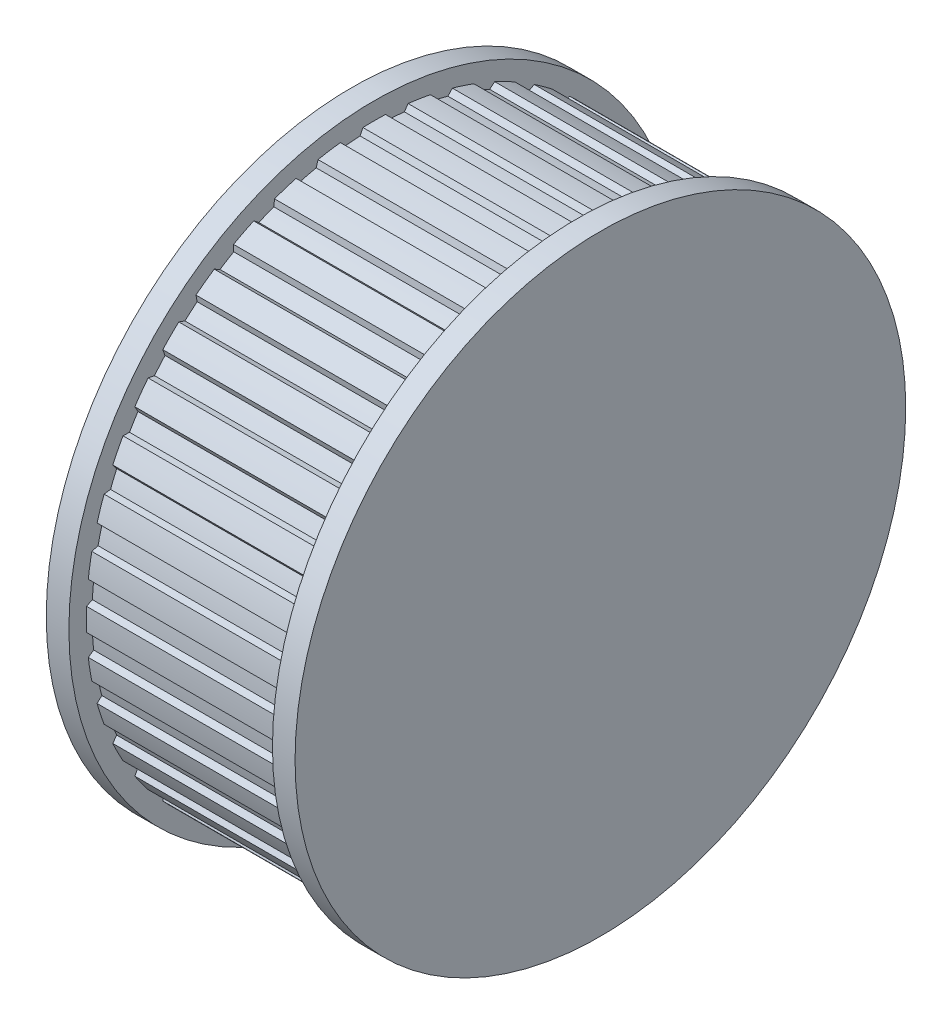
from build123d import *

# Parameters (mm, degrees)
BOSS_EXTRUDE1_DEPTH     = 9
SKETCH6_R               = 13.5
BOSS_EXTRUDE2_DEPTH     = 1
BOSS_EXTRUDE3_START     = -10
SKETCH6_3_R             = 13.5
BOSS_EXTRUDE3_DEPTH     = 1
SKETCH7_R               = 5
BOSS_EXTRUDE4_DEPTH     = 6
SKETCH8_R               = 2
CUT_EXTRUDE1_DEPTH      = 6
CUT_EXTRUDE2_REACH      = 26.99
CUT_EXTRUDE2_END_RADIUS = 2
SKETCH9_R               = 1.6


with BuildPart() as part:
    # Sketch5 → Boss-Extrude1 (new body)
    with BuildSketch(Plane(origin=(0, 0, 0), x_dir=(0, 0, -1), z_dir=(1, 0, 0))):
        with BuildLine():
            Line((-0.622813523, 12.459443339), (-0.499777455, 12.720185631))
            ThreePointArc((-0.499777455, 12.720185631), (0, 12.73), (0.499777455, 12.720185631))
            Line((0.499777455, 12.720185631), (0.622813523, 12.459443339))
            ThreePointArc((0.622813523, 12.459443339), (0.978777219, 12.436543738), (1.333940698, 12.403476416))
            Line((1.333940698, 12.403476416), (1.49625107, 12.641761457))
            ThreePointArc((1.49625107, 12.641761457), (1.99141074, 12.573272576), (2.483499799, 12.48539662))
            Line((2.483499799, 12.48539662), (2.564232009, 12.208617416))
            ThreePointArc((2.564232009, 12.208617416), (2.912230914, 12.130314757), (3.257848872, 12.04209474))
            Line((3.257848872, 12.04209474), (3.455436927, 12.25205516))
            ThreePointArc((3.455436927, 12.25205516), (3.933786338, 12.106949452), (4.406070137, 11.943175706))
            Line((4.406070137, 11.943175706), (4.442510592, 11.657174814))
            ThreePointArc((4.442510592, 11.657174814), (4.773975819, 11.525397168), (5.101537995, 11.384196725))
            Line((5.101537995, 11.384196725), (5.329538459, 11.560662603))
            ThreePointArc((5.329538459, 11.560662603), (5.779299062, 11.342513053), (6.220148404, 11.10687417))
            Line((6.220148404, 11.10687417), (6.211399821, 10.81869388))
            ThreePointArc((6.211399821, 10.81869388), (6.518169595, 10.63668605), (6.819610322, 10.445982006))
            Line((6.819610322, 10.445982006), (7.072409066, 10.584608165))
            ThreePointArc((7.072409066, 10.584608165), (7.482506262, 10.298786338), (7.881065975, 9.99708453))
            Line((7.881065975, 9.99708453), (7.827343771, 9.713820798))
            ThreePointArc((7.827343771, 9.713820798), (8.101864403, 9.486064421), (8.369761209, 9.250552541))
            Line((8.369761209, 9.250552541), (8.641133491, 9.347925545))
            ThreePointArc((8.641133491, 9.347925545), (9.001469325, 9.001469325), (9.347925545, 8.641133491))
            Line((9.347925545, 8.641133491), (9.250552541, 8.369761209))
            ThreePointArc((9.250552541, 8.369761209), (9.486064421, 8.101864403), (9.713820798, 7.827343771))
            Line((9.713820798, 7.827343771), (9.99708453, 7.881065975))
            ThreePointArc((9.99708453, 7.881065975), (10.298786338, 7.482506262), (10.584608165, 7.072409066))
            Line((10.584608165, 7.072409066), (10.445982006, 6.819610322))
            ThreePointArc((10.445982006, 6.819610322), (10.63668605, 6.518169595), (10.81869388, 6.211399821))
            Line((10.81869388, 6.211399821), (11.10687417, 6.220148404))
            ThreePointArc((11.10687417, 6.220148404), (11.342513053, 5.779299062), (11.560662603, 5.329538459))
            Line((11.560662603, 5.329538459), (11.384196725, 5.101537995))
            ThreePointArc((11.384196725, 5.101537995), (11.525397168, 4.773975819), (11.657174814, 4.442510592))
            Line((11.657174814, 4.442510592), (11.943175706, 4.406070137))
            ThreePointArc((11.943175706, 4.406070137), (12.106949452, 3.933786338), (12.25205516, 3.455436927))
            Line((12.25205516, 3.455436927), (12.04209474, 3.257848872))
            ThreePointArc((12.04209474, 3.257848872), (12.130314757, 2.912230914), (12.208617416, 2.564232009))
            Line((12.208617416, 2.564232009), (12.48539662, 2.483499799))
            ThreePointArc((12.48539662, 2.483499799), (12.573272576, 1.99141074), (12.641761457, 1.49625107))
            Line((12.641761457, 1.49625107), (12.403476416, 1.333940698))
            ThreePointArc((12.403476416, 1.333940698), (12.436543738, 0.978777219), (12.459443339, 0.622813523))
            Line((12.459443339, 0.622813523), (12.720185631, 0.499777455))
            ThreePointArc((12.720185631, 0.499777455), (12.73, 0), (12.720185631, -0.499777455))
            Line((12.720185631, -0.499777455), (12.459443339, -0.622813523))
            ThreePointArc((12.459443339, -0.622813523), (12.436543738, -0.978777219), (12.403476416, -1.333940698))
            Line((12.403476416, -1.333940698), (12.641761457, -1.49625107))
            ThreePointArc((12.641761457, -1.49625107), (12.573272576, -1.99141074), (12.48539662, -2.483499799))
            Line((12.48539662, -2.483499799), (12.208617416, -2.564232009))
            ThreePointArc((12.208617416, -2.564232009), (12.130314757, -2.912230914), (12.04209474, -3.257848872))
            Line((12.04209474, -3.257848872), (12.25205516, -3.455436927))
            ThreePointArc((12.25205516, -3.455436927), (12.106949452, -3.933786338), (11.943175706, -4.406070137))
            Line((11.943175706, -4.406070137), (11.657174814, -4.442510592))
            ThreePointArc((11.657174814, -4.442510592), (11.525397168, -4.773975819), (11.384196725, -5.101537995))
            Line((11.384196725, -5.101537995), (11.560662603, -5.329538459))
            ThreePointArc((11.560662603, -5.329538459), (11.342513053, -5.779299062), (11.10687417, -6.220148404))
            Line((11.10687417, -6.220148404), (10.81869388, -6.211399821))
            ThreePointArc((10.81869388, -6.211399821), (10.63668605, -6.518169595), (10.445982006, -6.819610322))
            Line((10.445982006, -6.819610322), (10.584608165, -7.072409066))
            ThreePointArc((10.584608165, -7.072409066), (10.298786338, -7.482506262), (9.99708453, -7.881065975))
            Line((9.99708453, -7.881065975), (9.713820798, -7.827343771))
            ThreePointArc((9.713820798, -7.827343771), (9.486064421, -8.101864403), (9.250552541, -8.369761209))
            Line((9.250552541, -8.369761209), (9.347925545, -8.641133491))
            ThreePointArc((9.347925545, -8.641133491), (9.001469325, -9.001469325), (8.641133491, -9.347925545))
            Line((8.641133491, -9.347925545), (8.369761209, -9.250552541))
            ThreePointArc((8.369761209, -9.250552541), (8.101864403, -9.486064421), (7.827343771, -9.713820798))
            Line((7.827343771, -9.713820798), (7.881065975, -9.99708453))
            ThreePointArc((7.881065975, -9.99708453), (7.482506262, -10.298786338), (7.072409066, -10.584608165))
            Line((7.072409066, -10.584608165), (6.819610322, -10.445982006))
            ThreePointArc((6.819610322, -10.445982006), (6.518169595, -10.63668605), (6.211399821, -10.81869388))
            Line((6.211399821, -10.81869388), (6.220148404, -11.10687417))
            ThreePointArc((6.220148404, -11.10687417), (5.779299062, -11.342513053), (5.329538459, -11.560662603))
            Line((5.329538459, -11.560662603), (5.101537995, -11.384196725))
            ThreePointArc((5.101537995, -11.384196725), (4.773975819, -11.525397168), (4.442510592, -11.657174814))
            Line((4.442510592, -11.657174814), (4.406070137, -11.943175706))
            ThreePointArc((4.406070137, -11.943175706), (3.933786338, -12.106949452), (3.455436927, -12.25205516))
            Line((3.455436927, -12.25205516), (3.257848872, -12.04209474))
            ThreePointArc((3.257848872, -12.04209474), (2.912230914, -12.130314757), (2.564232009, -12.208617416))
            Line((2.564232009, -12.208617416), (2.483499799, -12.48539662))
            ThreePointArc((2.483499799, -12.48539662), (1.99141074, -12.573272576), (1.49625107, -12.641761457))
            Line((1.49625107, -12.641761457), (1.333940698, -12.403476416))
            ThreePointArc((1.333940698, -12.403476416), (0.978777219, -12.436543738), (0.622813523, -12.459443339))
            Line((0.622813523, -12.459443339), (0.499777455, -12.720185631))
            ThreePointArc((0.499777455, -12.720185631), (0, -12.73), (-0.499777455, -12.720185631))
            Line((-0.499777455, -12.720185631), (-0.622813523, -12.459443339))
            ThreePointArc((-0.622813523, -12.459443339), (-0.978777219, -12.436543738), (-1.333940698, -12.403476416))
            Line((-1.333940698, -12.403476416), (-1.49625107, -12.641761457))
            ThreePointArc((-1.49625107, -12.641761457), (-1.99141074, -12.573272576), (-2.483499799, -12.48539662))
            Line((-2.483499799, -12.48539662), (-2.564232009, -12.208617416))
            ThreePointArc((-2.564232009, -12.208617416), (-2.912230914, -12.130314757), (-3.257848872, -12.04209474))
            Line((-3.257848872, -12.04209474), (-3.455436927, -12.25205516))
            ThreePointArc((-3.455436927, -12.25205516), (-3.933786338, -12.106949452), (-4.406070137, -11.943175706))
            Line((-4.406070137, -11.943175706), (-4.442510592, -11.657174814))
            ThreePointArc((-4.442510592, -11.657174814), (-4.773975819, -11.525397168), (-5.101537995, -11.384196725))
            Line((-5.101537995, -11.384196725), (-5.329538459, -11.560662603))
            ThreePointArc((-5.329538459, -11.560662603), (-5.779299062, -11.342513053), (-6.220148404, -11.10687417))
            Line((-6.220148404, -11.10687417), (-6.211399821, -10.81869388))
            ThreePointArc((-6.211399821, -10.81869388), (-6.518169595, -10.63668605), (-6.819610322, -10.445982006))
            Line((-6.819610322, -10.445982006), (-7.072409066, -10.584608165))
            ThreePointArc((-7.072409066, -10.584608165), (-7.482506262, -10.298786338), (-7.881065975, -9.99708453))
            Line((-7.881065975, -9.99708453), (-7.827343771, -9.713820798))
            ThreePointArc((-7.827343771, -9.713820798), (-8.101864403, -9.486064421), (-8.369761209, -9.250552541))
            Line((-8.369761209, -9.250552541), (-8.641133491, -9.347925545))
            ThreePointArc((-8.641133491, -9.347925545), (-9.001469325, -9.001469325), (-9.347925545, -8.641133491))
            Line((-9.347925545, -8.641133491), (-9.250552541, -8.369761209))
            ThreePointArc((-9.250552541, -8.369761209), (-9.486064421, -8.101864403), (-9.713820798, -7.827343771))
            Line((-9.713820798, -7.827343771), (-9.99708453, -7.881065975))
            ThreePointArc((-9.99708453, -7.881065975), (-10.298786338, -7.482506262), (-10.584608165, -7.072409066))
            Line((-10.584608165, -7.072409066), (-10.445982006, -6.819610322))
            ThreePointArc((-10.445982006, -6.819610322), (-10.63668605, -6.518169595), (-10.81869388, -6.211399821))
            Line((-10.81869388, -6.211399821), (-11.10687417, -6.220148404))
            ThreePointArc((-11.10687417, -6.220148404), (-11.342513053, -5.779299062), (-11.560662603, -5.329538459))
            Line((-11.560662603, -5.329538459), (-11.384196725, -5.101537995))
            ThreePointArc((-11.384196725, -5.101537995), (-11.525397168, -4.773975819), (-11.657174814, -4.442510592))
            Line((-11.657174814, -4.442510592), (-11.943175706, -4.406070137))
            ThreePointArc((-11.943175706, -4.406070137), (-12.106949452, -3.933786338), (-12.25205516, -3.455436927))
            Line((-12.25205516, -3.455436927), (-12.04209474, -3.257848872))
            ThreePointArc((-12.04209474, -3.257848872), (-12.130314757, -2.912230914), (-12.208617416, -2.564232009))
            Line((-12.208617416, -2.564232009), (-12.48539662, -2.483499799))
            ThreePointArc((-12.48539662, -2.483499799), (-12.573272576, -1.99141074), (-12.641761457, -1.49625107))
            Line((-12.641761457, -1.49625107), (-12.403476416, -1.333940698))
            ThreePointArc((-12.403476416, -1.333940698), (-12.436543738, -0.978777219), (-12.459443339, -0.622813523))
            Line((-12.459443339, -0.622813523), (-12.720185631, -0.499777455))
            ThreePointArc((-12.720185631, -0.499777455), (-12.73, 0), (-12.720185631, 0.499777455))
            Line((-12.720185631, 0.499777455), (-12.459443339, 0.622813523))
            ThreePointArc((-12.459443339, 0.622813523), (-12.436543738, 0.978777219), (-12.403476416, 1.333940698))
            Line((-12.403476416, 1.333940698), (-12.641761457, 1.49625107))
            ThreePointArc((-12.641761457, 1.49625107), (-12.573272576, 1.99141074), (-12.48539662, 2.483499799))
            Line((-12.48539662, 2.483499799), (-12.208617416, 2.564232009))
            ThreePointArc((-12.208617416, 2.564232009), (-12.130314757, 2.912230914), (-12.04209474, 3.257848872))
            Line((-12.04209474, 3.257848872), (-12.25205516, 3.455436927))
            ThreePointArc((-12.25205516, 3.455436927), (-12.106949452, 3.933786338), (-11.943175706, 4.406070137))
            Line((-11.943175706, 4.406070137), (-11.657174814, 4.442510592))
            ThreePointArc((-11.657174814, 4.442510592), (-11.525397168, 4.773975819), (-11.384196725, 5.101537995))
            Line((-11.384196725, 5.101537995), (-11.560662603, 5.329538459))
            ThreePointArc((-11.560662603, 5.329538459), (-11.342513053, 5.779299062), (-11.10687417, 6.220148404))
            Line((-11.10687417, 6.220148404), (-10.81869388, 6.211399821))
            ThreePointArc((-10.81869388, 6.211399821), (-10.63668605, 6.518169595), (-10.445982006, 6.819610322))
            Line((-10.445982006, 6.819610322), (-10.584608165, 7.072409066))
            ThreePointArc((-10.584608165, 7.072409066), (-10.298786338, 7.482506262), (-9.99708453, 7.881065975))
            Line((-9.99708453, 7.881065975), (-9.713820798, 7.827343771))
            ThreePointArc((-9.713820798, 7.827343771), (-9.486064421, 8.101864403), (-9.250552541, 8.369761209))
            Line((-9.250552541, 8.369761209), (-9.347925545, 8.641133491))
            ThreePointArc((-9.347925545, 8.641133491), (-9.001469325, 9.001469325), (-8.641133491, 9.347925545))
            Line((-8.641133491, 9.347925545), (-8.369761209, 9.250552541))
            ThreePointArc((-8.369761209, 9.250552541), (-8.101864403, 9.486064421), (-7.827343771, 9.713820798))
            Line((-7.827343771, 9.713820798), (-7.881065975, 9.99708453))
            ThreePointArc((-7.881065975, 9.99708453), (-7.482506262, 10.298786338), (-7.072409066, 10.584608165))
            Line((-7.072409066, 10.584608165), (-6.819610322, 10.445982006))
            ThreePointArc((-6.819610322, 10.445982006), (-6.518169595, 10.63668605), (-6.211399821, 10.81869388))
            Line((-6.211399821, 10.81869388), (-6.220148404, 11.10687417))
            ThreePointArc((-6.220148404, 11.10687417), (-5.779299062, 11.342513053), (-5.329538459, 11.560662603))
            Line((-5.329538459, 11.560662603), (-5.101537995, 11.384196725))
            ThreePointArc((-5.101537995, 11.384196725), (-4.773975819, 11.525397168), (-4.442510592, 11.657174814))
            Line((-4.442510592, 11.657174814), (-4.406070137, 11.943175706))
            ThreePointArc((-4.406070137, 11.943175706), (-3.933786338, 12.106949452), (-3.455436927, 12.25205516))
            Line((-3.455436927, 12.25205516), (-3.257848872, 12.04209474))
            ThreePointArc((-3.257848872, 12.04209474), (-2.912230914, 12.130314757), (-2.564232009, 12.208617416))
            Line((-2.564232009, 12.208617416), (-2.483499799, 12.48539662))
            ThreePointArc((-2.483499799, 12.48539662), (-1.99141074, 12.573272576), (-1.49625107, 12.641761457))
            Line((-1.49625107, 12.641761457), (-1.333940698, 12.403476416))
            ThreePointArc((-1.333940698, 12.403476416), (-0.978777219, 12.436543738), (-0.622813523, 12.459443339))
        make_face()
    extrude(amount=BOSS_EXTRUDE1_DEPTH)

    # Sketch6 → Boss-Extrude2 (add)
    with BuildSketch(Plane(origin=(9, 0, 0), x_dir=(0, 0, -1), z_dir=(1, 0, 0))):
        Circle(SKETCH6_R)
    extrude(amount=BOSS_EXTRUDE2_DEPTH)

    # Sketch6<3> → Boss-Extrude3 (add)
    with BuildSketch(Plane(origin=(9, 0, 0), x_dir=(0, 0, -1), z_dir=(1, 0, 0)).offset(BOSS_EXTRUDE3_START)):
        Circle(SKETCH6_3_R)
    extrude(amount=BOSS_EXTRUDE3_DEPTH)

    # Sketch7 → Boss-Extrude4 (add)
    with BuildSketch(Plane.ZY.offset(1)):
        Circle(SKETCH7_R)
    extrude(amount=BOSS_EXTRUDE4_DEPTH)

    # Sketch8 → Cut-Extrude1 (cut)
    with BuildSketch(Plane.ZY.offset(7)):
        Circle(SKETCH8_R)
    extrude(amount=-CUT_EXTRUDE1_DEPTH, mode=Mode.SUBTRACT)

    # Cut-Extrude2: up to this cylinder (the profile starts outside it)
    cut_extrude2_end = Plane(origin=(-4, 0, 0), z_dir=(-1, 0, 0)) * Cylinder(CUT_EXTRUDE2_END_RADIUS, 58.98, mode=Mode.PRIVATE)
    # Sketch9 → Cut-Extrude2 (cut, up to the surface)
    with BuildSketch(Plane(origin=(0, 5, 0), x_dir=(1, 0, 0), z_dir=(0, 1, 0)), mode=Mode.PRIVATE) as cut_extrude2_sk1:
        with Locations(Location((-4, 0, 0), (0, 0, 270))):
            Circle(SKETCH9_R)
    cut_extrude2_tool1 = extrude(cut_extrude2_sk1.sketch, amount=-CUT_EXTRUDE2_REACH, mode=Mode.PRIVATE) - cut_extrude2_end
    add(cut_extrude2_tool1.solids().sort_by_distance((-4, 5, 0))[0], mode=Mode.SUBTRACT)


solid = part.part
